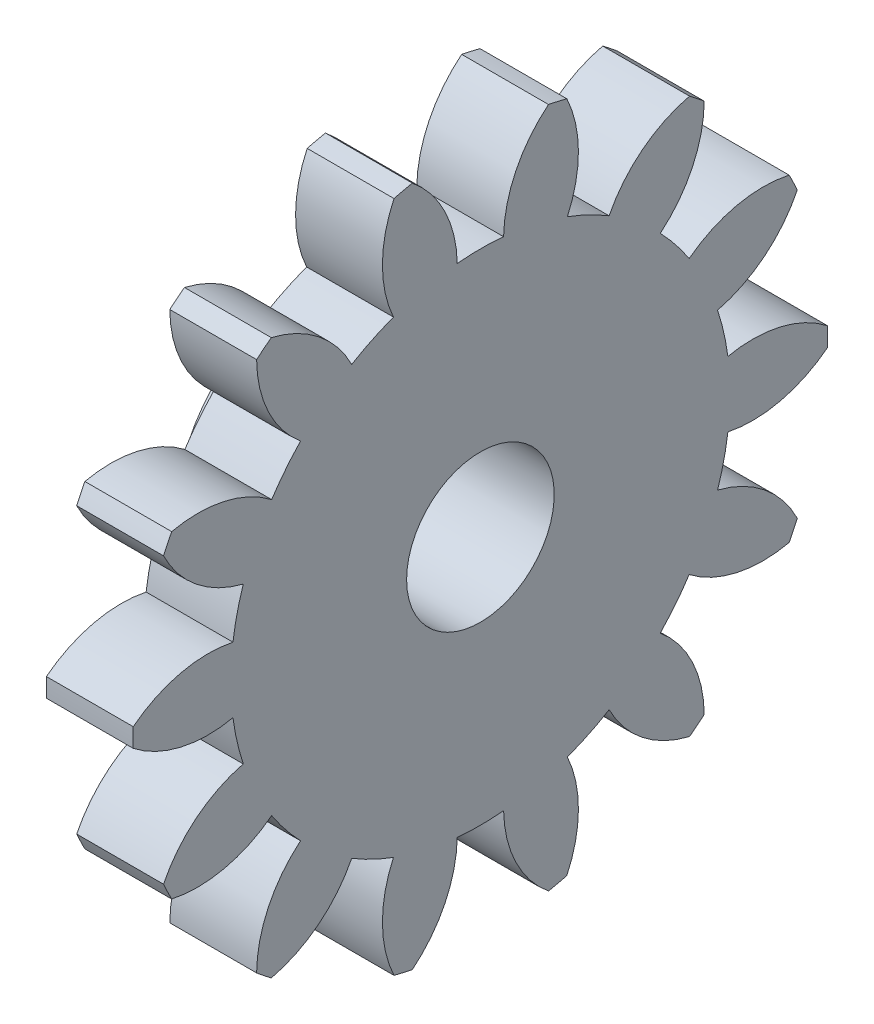
from build123d import *

# Parameters (mm, degrees)
BASPROSKE_W             = 10
BASPROSKE_H             = 40
TOOTHCUT_DEPTH          = 58.445626465
TEETHCUTS_COUNT         = 14
HUBNEAONESKE_R          = 15
HUBNEARONE_DEPTH        = 10.0000508
BORSKE_R                = 8.5
BORE_DEPTH              = 20.0000508
CUT_EXTRUDE1_DEPTH      = 57.907695162
CUT_EXTRUDE1_DEPTH_BACK = 57.907695162
SKETCH1_R               = 1.75


with BuildPart() as part:
    # BasProSke → Base-Revolve (revolve)
    with BuildSketch(Plane(origin=(0, 0, 0), x_dir=(1, 0, 0), z_dir=(0, 1, 0)), mode=Mode.PRIVATE) as base_revolve_sk:
        with Locations((5, 20)):
            Rectangle(BASPROSKE_W, BASPROSKE_H)
    revolve(base_revolve_sk.sketch.rotate(Axis((-10, 0, 0), (1, 0, 0)), 180), axis=Axis((-10, 0, 0), (1, 0, 0)))

    # TooCutSke → ToothCut (cut, through all)
    with BuildSketch(Plane(origin=(0, 0, 0), x_dir=(0, 0, -1), z_dir=(1, 0, 0))):
        with BuildLine():
            ThreePointArc((2.668955068, 28.624843752), (0, 28.749), (-2.668955068, 28.624843752))
            ThreePointArc((-2.668955068, 28.624843752), (-4.092749085, 34.510467305), (-7.86881342, 39.244291566))
            ThreePointArc((-7.86881342, 39.244291566), (0, 40.0254), (7.86881342, 39.244291566))
            ThreePointArc((7.86881342, 39.244291566), (4.092749085, 34.510467305), (2.668955068, 28.624843752))
        make_face()
    toothcut = extrude(amount=TOOTHCUT_DEPTH, mode=Mode.SUBTRACT)

    # TeethCuts: ToothCut ×14 about axis
    teethcuts_axis = Axis((0, 0, 0), (1, 0, 0))
    for i in range(1, TEETHCUTS_COUNT):
        add(toothcut.rotate(teethcuts_axis, i * 360 / TEETHCUTS_COUNT), mode=Mode.SUBTRACT)

    # HubNeaOneSke → HubNearOne (add)
    with BuildSketch(Plane.ZY):
        with Locations(Location((0, 0, 0), (0, 0, 180))):
            Circle(HUBNEAONESKE_R)
    extrude(amount=HUBNEARONE_DEPTH)

    # BorSke → Bore (cut, symmetric)
    with BuildSketch(Plane(origin=(0, 0, 0), x_dir=(0, 0, -1), z_dir=(1, 0, 0))):
        with Locations(Location((0, 0, 0), (0, 0, 180))):
            Circle(BORSKE_R)
    extrude(amount=BORE_DEPTH, both=True, mode=Mode.SUBTRACT)

    # Sketch1 → Cut-Extrude1 (cut, two sides: drawn at the far end of the back side and taken through both)
    with BuildSketch(Plane(origin=(0, 0, 0), x_dir=(1, 0, 0), z_dir=(0, 1, 0)).offset(-CUT_EXTRUDE1_DEPTH_BACK)):
        with Locations(Location((-5.0000508, 0, 0), (0, 0, 270))):
            Circle(SKETCH1_R)
    extrude(amount=CUT_EXTRUDE1_DEPTH + CUT_EXTRUDE1_DEPTH_BACK, mode=Mode.SUBTRACT)


solid = part.part
